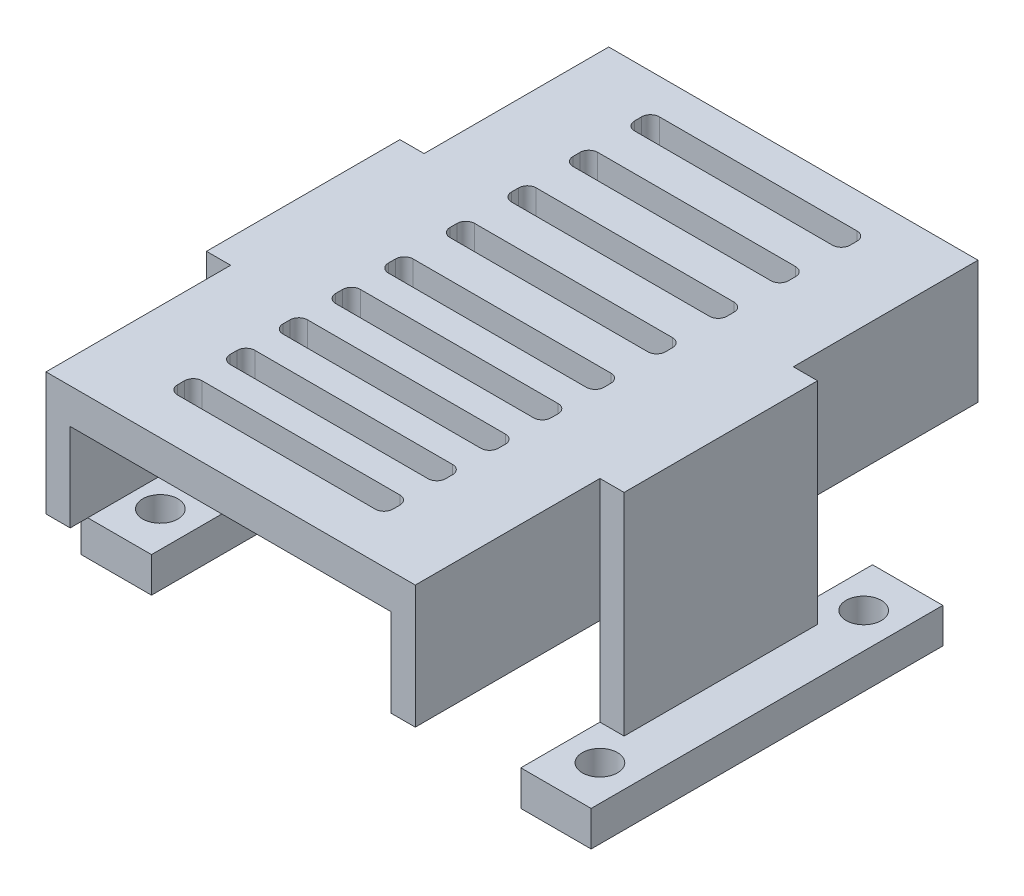
from build123d import *

# Parameters (mm, degrees)
BOSS_EXTRUDE1_DEPTH      = 32
CUT_EXTRUDE5_DEPTH       = 3.999999672
LPATTERN1_COUNT          = 5
LPATTERN1_PITCH          = 7
LPATTERN2_COUNT          = 5
LPATTERN2_PITCH          = 6
SKETCH12_W               = 8
SKETCH12_H               = 4
CUT_EXTRUDE7_DEPTH       = 12
CUT_EXTRUDE8_DEPTH       = 17
CUT_EXTRUDE8_DEPTH_BACK  = 4
SKETCH11_W               = 8
SKETCH11_H               = 31.059426665
CUT_EXTRUDE10_DEPTH      = 17
CUT_EXTRUDE10_DEPTH_BACK = 4
SKETCH13_W               = 10.75
SKETCH13_H               = 28.869342983
SKETCH13_W_2             = 7.056880225
SKETCH13_H_2             = 29.936318605
F_4_0MM_DOWEL_HOLE1_D    = 4


with BuildPart() as part:
    # Sketch1 → Boss-Extrude1 (new, symmetric)
    with BuildSketch(Plane.XY):
        Polygon((-23.75, 31.999999672), (23.75, 31.999999672), (23.75, 8), (29, 8), (29, 4), (21, 4), (21, 18), (18.25, 18), (18.25, 28), (-18.25, 28), (-18.25, 18), (-21, 18), (-21, 4), (-29, 4), (-29, 8), (-23.75, 8), align=None)
    extrude(amount=BOSS_EXTRUDE1_DEPTH, both=True)

    # Sketch8 → Cut-Extrude5 (cut)
    with BuildSketch(Plane(origin=(0, 31.999999672, 0), x_dir=(1, 0, 0), z_dir=(0, 1, 0))):
        with BuildLine():
            Line((11.25, -2.8), (-11.25, -2.8))
            ThreePointArc((-11.25, -2.8), (-11.957106781, -2.507106781), (-12.25, -1.8))
            Line((-12.25, -1.8), (-12.25, -1))
            ThreePointArc((-12.25, -1), (-11.957106781, -0.292893219), (-11.25, 0))
            Line((-11.25, 0), (11.25, 0))
            ThreePointArc((11.25, 0), (11.957106781, -0.292893219), (12.25, -1))
            Line((12.25, -1), (12.25, -1.8))
            ThreePointArc((12.25, -1.8), (11.957106781, -2.507106781), (11.25, -2.8))
        make_face()
    cut_extrude5 = extrude(amount=-CUT_EXTRUDE5_DEPTH, mode=Mode.SUBTRACT)

    # LPattern1: Cut-Extrude5 ×5
    with Locations(*[(0, 0, -i * LPATTERN1_PITCH) for i in range(1, LPATTERN1_COUNT)]):
        add(cut_extrude5, mode=Mode.SUBTRACT)

    # LPattern2: Cut-Extrude5 ×5
    with Locations(*[(0, 0, i * LPATTERN2_PITCH) for i in range(1, LPATTERN2_COUNT)]):
        add(cut_extrude5, mode=Mode.SUBTRACT)

    # Sketch12 → Cut-Extrude7 (cut)
    with BuildSketch(Plane(origin=(0, 0, -32), x_dir=(-1, 0, 0), z_dir=(0, 0, -1))):
        with Locations((25, 6)):
            Rectangle(SKETCH12_W, SKETCH12_H)
        with Locations((-25, 6)):
            Rectangle(SKETCH12_W, SKETCH12_H)
    cut_extrude7 = extrude(amount=-CUT_EXTRUDE7_DEPTH, mode=Mode.SUBTRACT)

    # Mirror1: Cut-Extrude7 across plane
    add(cut_extrude7.mirror(Plane.XY), mode=Mode.SUBTRACT)

    # Sketch11 → Cut-Extrude8 (cut, two sides: drawn at the far end of the back side and taken through both)
    with BuildSketch(Plane(origin=(0, 0, -15), x_dir=(-1, 0, 0), z_dir=(0, 0, -1)).offset(-CUT_EXTRUDE8_DEPTH_BACK)):
        with Locations((25, 23.529713333)):
            Rectangle(SKETCH11_W, SKETCH11_H)
        with Locations((-25, 23.529713333)):
            Rectangle(SKETCH11_W, SKETCH11_H)
    extrude(amount=CUT_EXTRUDE8_DEPTH + CUT_EXTRUDE8_DEPTH_BACK, mode=Mode.SUBTRACT)

    # Sketch13 → Cut-Extrude10 (cut, two sides: drawn at the far end of the back side and taken through both)
    with BuildSketch(Plane.XY.offset(15).offset(-CUT_EXTRUDE10_DEPTH_BACK)):
        with Locations((26.375, 22.434671492)):
            Rectangle(SKETCH13_W, SKETCH13_H)
        with Locations((-24.528440113, 22.968159303)):
            Rectangle(SKETCH13_W_2, SKETCH13_H_2)
    extrude(amount=CUT_EXTRUDE10_DEPTH + CUT_EXTRUDE10_DEPTH_BACK, mode=Mode.SUBTRACT)

    # Ø4.0mm Dowel Hole1 (through all)
    with Locations(Plane(origin=(0, 8, 0), x_dir=(1, 0, 0), z_dir=(0, 1, 0))):
        with Locations((25, -15), (25, 15), (-25, 15), (-25, -15)):
            Hole(F_4_0MM_DOWEL_HOLE1_D / 2)


solid = part.part
